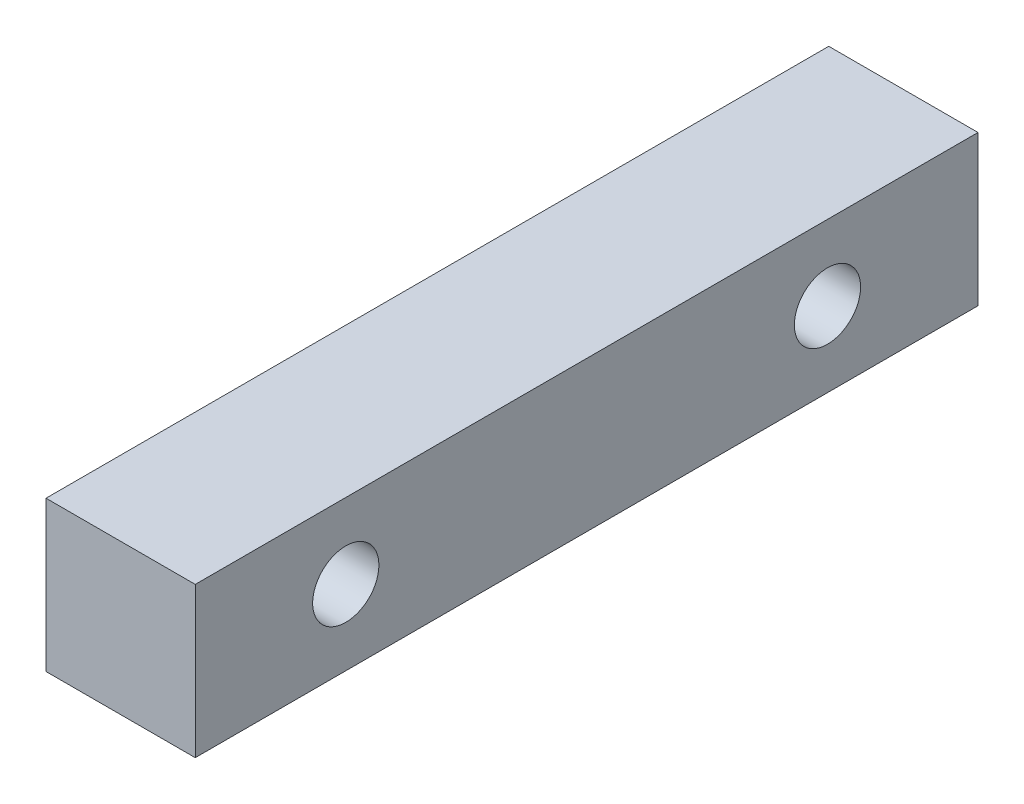
from build123d import *

# Parameters (mm, degrees)
SKETCH1_W           = 12.394273752
SKETCH1_H           = 12.46455313
BOSS_EXTRUDE1_DEPTH = 65
CUT_EXTRUDE1_START  = -12.394274
SKETCH2_R           = 2.75
CUT_EXTRUDE1_DEPTH  = 12.394274


with BuildPart() as part:
    # Sketch1 → Boss-Extrude1 (new body)
    with BuildSketch(Plane.XY):
        with Locations((-36.202863124, 114.417723435)):
            Rectangle(SKETCH1_W, SKETCH1_H)
    extrude(amount=-BOSS_EXTRUDE1_DEPTH)

    # Sketch2 → Cut-Extrude1 (cut)
    with BuildSketch(Plane.ZY.offset(42.4).offset(CUT_EXTRUDE1_START)):
        with Locations(Location((-52.5, 114.417723435, 0), (0, 0, 180))):
            Circle(SKETCH2_R)
        with Locations(Location((-12.5, 114.417723435, 0), (0, 0, 180))):
            Circle(SKETCH2_R)
    extrude(amount=CUT_EXTRUDE1_DEPTH, mode=Mode.SUBTRACT)


solid = part.part
